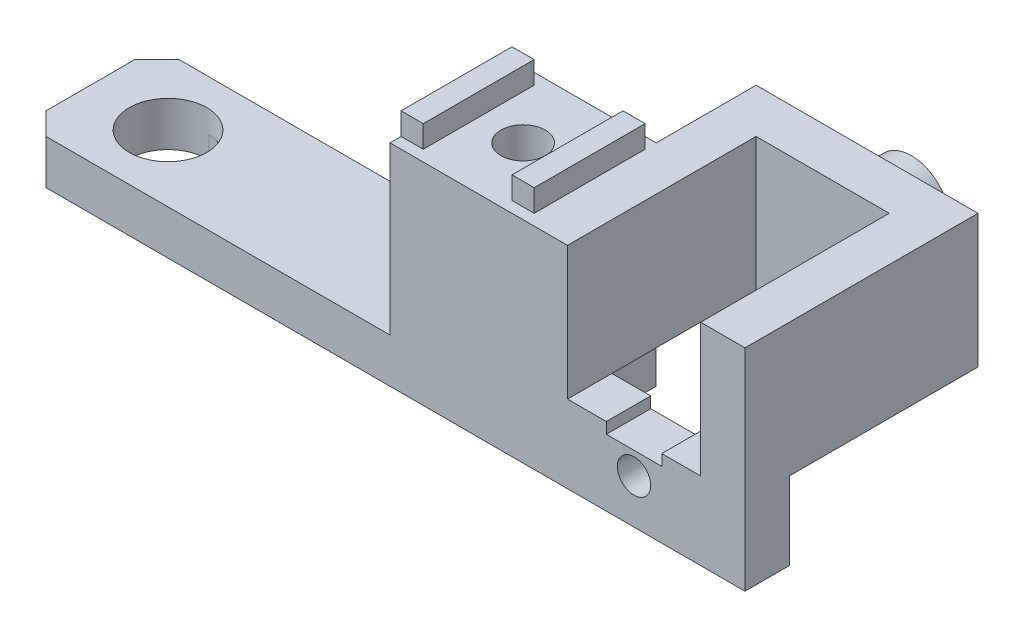
from build123d import *

# Parameters (mm, degrees)
BOSS_EXTRUDE1_DEPTH     = 4
SKETCH1_3_W             = 12
SKETCH1_3_H             = 12
BOSS_EXTRUDE2_DEPTH     = 19
BOSS_EXTRUDE3_DEPTH     = 7
BOSS_EXTRUDE4_START     = 19
SKETCH1_6_W             = 2
SKETCH1_6_H             = 5
BOSS_EXTRUDE4_DEPTH     = 2
BOSS_EXTRUDE5_DEPTH     = 12
BOSS_EXTRUDE6_DEPTH     = 4
SKETCH5_R               = 1.5
SKETCH5_W               = 5
SKETCH5_H               = 1
CUT_EXTRUDE1_DEPTH      = 73.739260376
CUT_EXTRUDE2_DEPTH      = 71.334913094
CUT_EXTRUDE2_DEPTH_BACK = 9
SKETCH6_R               = 2
SKETCH7_R               = 3.5
SKETCH7_R_2             = 2
CUT_EXTRUDE3_DEPTH      = 69.607579756
CUT_EXTRUDE4_DEPTH      = 2
CHAMFER1_SIZE           = 2


with BuildPart() as part:
    # Sketch1 → Boss-Extrude1 (new body)
    with BuildSketch(Plane(origin=(0, 0, 0), x_dir=(1, 0, 0), z_dir=(0, 1, 0))):
        with BuildLine():
            Line((33, 5), (33, 6))
            Line((33, 6), (0, 6))
            Line((0, 6), (0, 0))
            Line((0, 0), (3.5, 0))
            ThreePointArc((3.5, 0), (7, 3.5), (10.5, 0))
            Line((10.5, 0), (33, 0))
            Line((33, 0), (33, 5))
        make_face()
        with BuildLine():
            Line((33, -5), (33, 0))
            Line((33, 0), (10.5, 0))
            ThreePointArc((10.5, 0), (7, -3.5), (3.5, 0))
            Line((3.5, 0), (0, 0))
            Line((0, 0), (0, -6))
            Line((0, -6), (33, -6))
            Line((33, -6), (33, -5))
        make_face()
    extrude(amount=BOSS_EXTRUDE1_DEPTH)

    # Sketch1<3> → Boss-Extrude2 (add)
    with BuildSketch(Plane(origin=(0, 0, 0), x_dir=(1, 0, 0), z_dir=(0, 1, 0))):
        with Locations((39, 0)):
            Rectangle(SKETCH1_3_W, SKETCH1_3_H)
    extrude(amount=BOSS_EXTRUDE2_DEPTH)

    # Sketch1<4> → Boss-Extrude3 (add)
    with BuildSketch(Plane(origin=(0, 0, 0), x_dir=(1, 0, 0), z_dir=(0, 1, 0))):
        Polygon((65, -2), (45, -2), (45, -5), (45, -6), (65, -6), align=None)
    extrude(amount=BOSS_EXTRUDE3_DEPTH)

    # Sketch1<6> → Boss-Extrude4 (add)
    with BuildSketch(Plane(origin=(0, 0, 0), x_dir=(1, 0, 0), z_dir=(0, 1, 0)).offset(BOSS_EXTRUDE4_START)):
        with Locations((34, -2.5)):
            Rectangle(SKETCH1_6_W, SKETCH1_6_H)
        with Locations((34, 2.5)):
            Rectangle(SKETCH1_6_W, SKETCH1_6_H)
        Polygon((45, -2), (45, 0), (43, 0), (43, -5), (45, -5), align=None)
        with Locations((44, 2.5)):
            Rectangle(SKETCH1_6_W, SKETCH1_6_H)
    extrude(amount=BOSS_EXTRUDE4_DEPTH)

    # Sketch2 → Boss-Extrude5 (add)
    with BuildSketch(Plane(origin=(0, 7, 0), x_dir=(1, 0, 0), z_dir=(0, 1, 0))):
        Polygon((45, -6), (45, 15), (65, 15), (65, -6), (61, -6), (61, 11), (49, 11), (49, -6), align=None)
    extrude(amount=BOSS_EXTRUDE5_DEPTH)

    # Sketch4 → Boss-Extrude6 (add)
    with BuildSketch(Plane(origin=(0, 0, -15), x_dir=(-1, 0, 0), z_dir=(0, 0, -1))):
        with BuildLine():
            ThreePointArc((-51.5, 13), (-54.065732463, 16.373002249), (-58.00122524, 14.800735144))
            Line((-58.00122524, 14.800735144), (-51.99877476, 11.199264856))
            ThreePointArc((-51.99877476, 11.199264856), (-51.626997751, 12.065732463), (-51.5, 13))
        make_face()
        with BuildLine():
            Line((-51.99877476, 11.199264856), (-58.00122524, 14.800735144))
            ThreePointArc((-58.00122524, 14.800735144), (-56.800735144, 9.99877476), (-51.99877476, 11.199264856))
        make_face()
    extrude(amount=BOSS_EXTRUDE6_DEPTH)

    # Sketch5 → Cut-Extrude1 (cut, through all)
    with BuildSketch(Plane.XY.offset(6)):
        with Locations((55, 4)):
            Circle(SKETCH5_R)
        with Locations((55, 6.5)):
            Rectangle(SKETCH5_W, SKETCH5_H)
    extrude(amount=-CUT_EXTRUDE1_DEPTH, mode=Mode.SUBTRACT)

    # Sketch6 → Cut-Extrude2 (cut, two sides: drawn at the far end of the back side and taken through both)
    with BuildSketch(Plane(origin=(0, 19, 0), x_dir=(1, 0, 0), z_dir=(0, 1, 0)).offset(-CUT_EXTRUDE2_DEPTH_BACK)):
        with Locations(Location((39, 0, 0), (0, 0, 270))):
            Circle(SKETCH6_R)
    extrude(amount=CUT_EXTRUDE2_DEPTH + CUT_EXTRUDE2_DEPTH_BACK, mode=Mode.SUBTRACT)

    # Sketch7 → Cut-Extrude3 (cut, through all)
    # profile 1 of 2: a face of its own
    with BuildSketch(Plane(origin=(0, 10, 0), x_dir=(1, 0, 0), z_dir=(0, 1, 0))):
        with Locations(Location((39, 0, 0), (0, 0, 270))):
            Circle(SKETCH7_R)
        with Locations(Location((39, 0, 0), (0, 0, 270))):
            Circle(SKETCH7_R_2, mode=Mode.SUBTRACT)
    # profile 2 of 2: a face of its own
    with BuildSketch(Plane(origin=(0, 10, 0), x_dir=(1, 0, 0), z_dir=(0, 1, 0))):
        with Locations(Location((39, 0, 0), (0, 0, 270))):
            Circle(SKETCH7_R_2)
    extrude(amount=-CUT_EXTRUDE3_DEPTH, mode=Mode.SUBTRACT)

    # Sketch8 → Cut-Extrude4 (cut)
    with BuildSketch(Plane.XZ):
        with BuildLine():
            Line((31.125, 1.996089928), (7.21875, 3.493157374))
            ThreePointArc((7.21875, 3.493157374), (9.551041454, 2.396286189), (10.5, 0))
            ThreePointArc((10.5, 0), (9.551041454, -2.396286189), (7.21875, -3.493157374))
            Line((7.21875, -3.493157374), (31.125, -1.996089928))
            ThreePointArc((31.125, -1.996089928), (33, 0), (31.125, 1.996089928))
        make_face()
    extrude(amount=-CUT_EXTRUDE4_DEPTH, mode=Mode.SUBTRACT)

    # Chamfer1
    chamfer1_edges = [part.edges().sort_by_distance(p)[0] for p in [
        (0, 2, -6),
        (0, 2, 6),
    ]]
    chamfer(chamfer1_edges, length=CHAMFER1_SIZE)


solid = part.part
